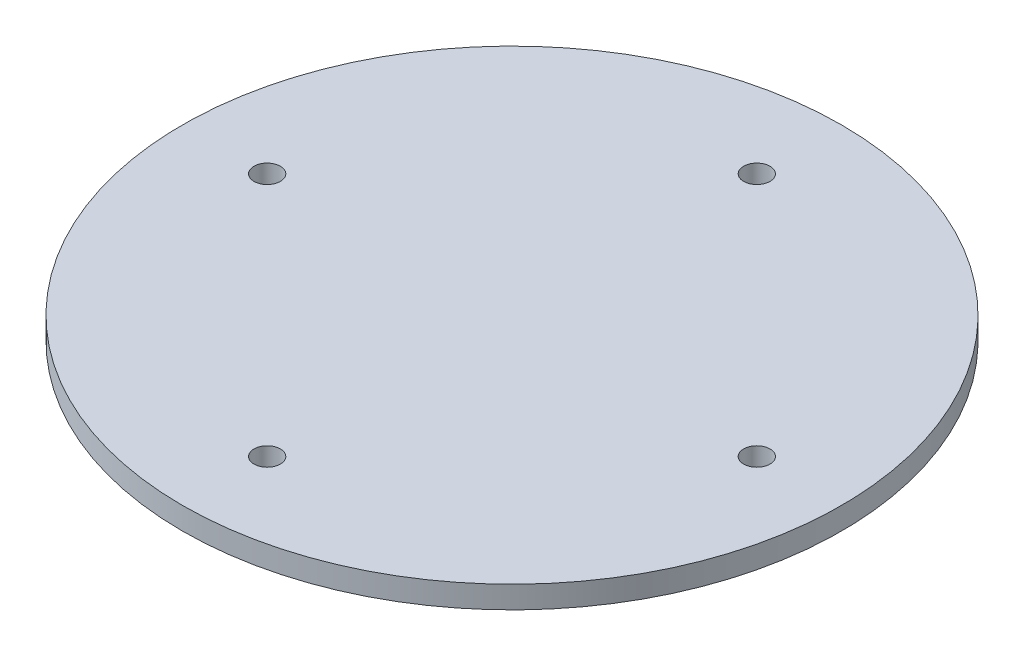
from build123d import *

# Parameters (mm, degrees)
SKETCH1_R           = 44.45
BOSS_EXTRUDE1_DEPTH = 3
SKETCH3_R           = 1.778
CUT_EXTRUDE1_DEPTH  = 63.933337747
CIRPATTERN1_COUNT   = 4


with BuildPart() as part:
    # Sketch1 → Boss-Extrude1 (new body)
    with BuildSketch(Plane(origin=(0, 0, 0), x_dir=(1, 0, 0), z_dir=(0, 1, 0))):
        with Locations(Location((0, 0, 0), (0, 0, 270))):
            Circle(SKETCH1_R)
    extrude(amount=BOSS_EXTRUDE1_DEPTH)

    # Sketch3 → Cut-Extrude1 (cut, through all)
    with BuildSketch(Plane(origin=(0, 3, 0), x_dir=(1, 0, 0), z_dir=(0, 1, 0))):
        with Locations(Location((33.02, 0, 0), (0, 0, 270))):
            Circle(SKETCH3_R)
    cut_extrude1 = extrude(amount=-CUT_EXTRUDE1_DEPTH, mode=Mode.SUBTRACT)

    # CirPattern1: Cut-Extrude1 ×4 about axis
    cirpattern1_axis = Axis((0, 0, 0), (0, 1, 0))
    for i in range(1, CIRPATTERN1_COUNT):
        add(cut_extrude1.rotate(cirpattern1_axis, i * 360 / CIRPATTERN1_COUNT), mode=Mode.SUBTRACT)


solid = part.part
